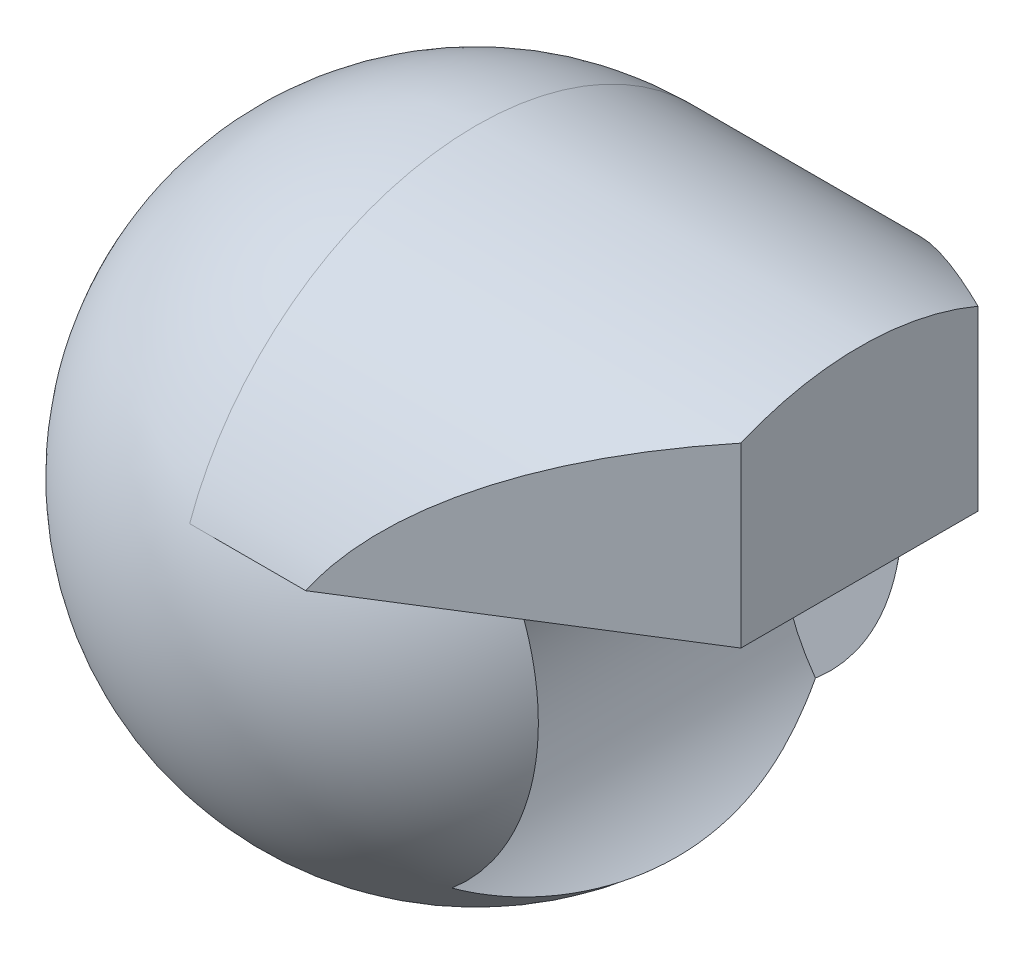
from build123d import *

# Parameters (mm, degrees)
BOSS_EXTRUDE2_DEPTH      = 25.4
BOSS_EXTRUDE2_DEPTH_BACK = 97.79
CUT_EXTRUDE1_DEPTH       = 251.97847836
CUT_EXTRUDE2_DEPTH       = 58.42
CUT_EXTRUDE2_DEPTH_BACK  = 58.42
SKETCH4_R                = 58.42


with BuildPart() as part:
    # Sketch1 → Revolve1 (revolve)
    with BuildSketch(Plane.XY):
        with BuildLine():
            Line((-195.58, 25.4), (0, 25.4))
            ThreePointArc((0, 25.4), (-97.79, 123.19), (-195.58, 25.4))
        make_face()
    revolve(axis=Axis((-195.58, 25.4, 0), (1, 0, 0)))

    # Sketch2 → Boss-Extrude2 (add, two sides: drawn at the far end of the back side and taken through both)
    with BuildSketch(Plane(origin=(0, 0, 0), x_dir=(0, 0, -1), z_dir=(1, 0, 0)).offset(-BOSS_EXTRUDE2_DEPTH_BACK)):
        with BuildLine():
            Line((-92.046530081, 58.42), (92.046530081, 58.42))
            ThreePointArc((92.046530081, 58.42), (0, 123.19), (-92.046530081, 58.42))
        make_face()
    extrude(amount=BOSS_EXTRUDE2_DEPTH + BOSS_EXTRUDE2_DEPTH_BACK)

    # Sketch3 → Cut-Extrude1 (cut, through all)
    with BuildSketch(Plane(origin=(0, 0, 0), x_dir=(1, 0, 0), z_dir=(0, 1, 0))):
        Polygon((25.4, -38.1), (25.4, 38.1), (-97.79, 115.482462919), (50.8, 115.482462919), (50.8, -115.482462919), (-97.79, -115.482462919), align=None)
    extrude(amount=CUT_EXTRUDE1_DEPTH, mode=Mode.SUBTRACT)

    # Sketch4 → Cut-Extrude2 (cut, two sides: drawn at the far end of the back side and taken through both)
    with BuildSketch(Plane.XY.offset(-CUT_EXTRUDE2_DEPTH_BACK)):
        Circle(SKETCH4_R)
    extrude(amount=CUT_EXTRUDE2_DEPTH + CUT_EXTRUDE2_DEPTH_BACK, mode=Mode.SUBTRACT)


solid = part.part
